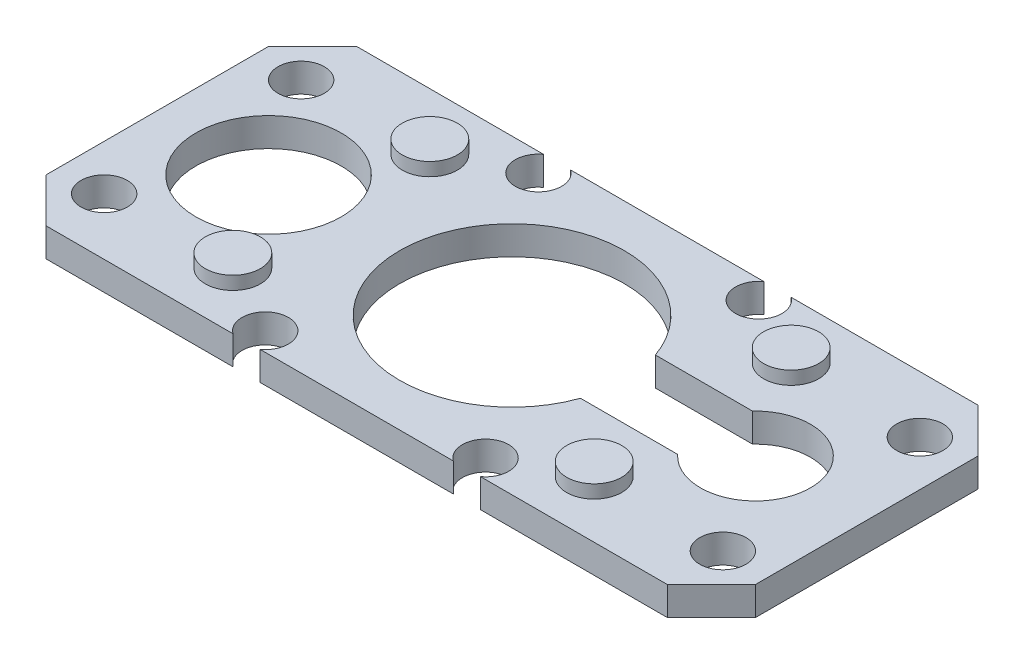
from build123d import *

# Parameters (mm, degrees)
SKETCH1_R           = 1.3335
SKETCH1_R_2         = 1.5875
BOSS_EXTRUDE1_DEPTH = 1.651
CHAMFER1_SIZE       = 2.54
SKETCH1_2_R         = 1.5875
BOSS_EXTRUDE2_DEPTH = 2.413
SKETCH1_3_R         = 1.5875
CUT_EXTRUDE1_DEPTH  = 0.889
SKETCH5_R           = 4.191
CUT_EXTRUDE5_DEPTH  = 23.382376376


with BuildPart() as part:
    # Sketch1 → Boss-Extrude1 (new body)
    with BuildSketch(Plane(origin=(0, 0, 0), x_dir=(1, 0, 0), z_dir=(0, 1, 0))):
        with BuildLine():
            Line((-5.567119422, 8.9535), (5.567119422, 8.9535))
            ThreePointArc((5.567119422, 8.9535), (6.35, 6.5405), (7.132880578, 8.9535))
            Line((7.132880578, 8.9535), (20.447, 8.9535))
            Line((20.447, 8.9535), (20.447, -8.9535))
            Line((20.447, -8.9535), (7.132880578, -8.9535))
            ThreePointArc((7.132880578, -8.9535), (6.35, -6.5405), (5.567119422, -8.9535))
            Line((5.567119422, -8.9535), (-5.567119422, -8.9535))
            ThreePointArc((-5.567119422, -8.9535), (-6.35, -6.5405), (-7.132880578, -8.9535))
            Line((-7.132880578, -8.9535), (-20.447, -8.9535))
            Line((-20.447, -8.9535), (-20.447, 8.9535))
            Line((-20.447, 8.9535), (-7.132880578, 8.9535))
            ThreePointArc((-7.132880578, 8.9535), (-6.35, 6.5405), (-5.567119422, 8.9535))
        make_face()
        with Locations((-17.8308, 5.6769)):
            Circle(SKETCH1_R, mode=Mode.SUBTRACT)
        with Locations((17.8308, 5.6769)):
            Circle(SKETCH1_R, mode=Mode.SUBTRACT)
        with Locations((17.8308, -5.6769)):
            Circle(SKETCH1_R, mode=Mode.SUBTRACT)
        with Locations((-17.8308, -5.6769)):
            Circle(SKETCH1_R, mode=Mode.SUBTRACT)
        with Locations((-10.414, 5.6769)):
            Circle(SKETCH1_R_2, mode=Mode.SUBTRACT)
        with Locations((10.414, 5.6769)):
            Circle(SKETCH1_R_2, mode=Mode.SUBTRACT)
        with Locations((10.414, -5.6769)):
            Circle(SKETCH1_R_2, mode=Mode.SUBTRACT)
        with Locations((-10.414, -5.6769)):
            Circle(SKETCH1_R_2, mode=Mode.SUBTRACT)
    extrude(amount=BOSS_EXTRUDE1_DEPTH)

    # Chamfer1
    chamfer1_edges = [part.edges().sort_by_distance(p)[0] for p in [
        (-20.447, 0.8255, 8.9535),
        (-20.447, 0.8255, -8.9535),
        (20.447, 0.8255, -8.9535),
        (20.447, 0.8255, 8.9535),
    ]]
    chamfer(chamfer1_edges, length=CHAMFER1_SIZE)

    # Sketch1<2> → Boss-Extrude2 (add)
    with BuildSketch(Plane(origin=(0, 0, 0), x_dir=(1, 0, 0), z_dir=(0, 1, 0))):
        with Locations((-10.414, 5.6769)):
            Circle(SKETCH1_2_R)
        with Locations((10.414, 5.6769)):
            Circle(SKETCH1_2_R)
        with Locations((10.414, -5.6769)):
            Circle(SKETCH1_2_R)
        with Locations((-10.414, -5.6769)):
            Circle(SKETCH1_2_R)
    extrude(amount=BOSS_EXTRUDE2_DEPTH)

    # Sketch1<3> → Cut-Extrude1 (cut)
    with BuildSketch(Plane(origin=(0, 0, 0), x_dir=(1, 0, 0), z_dir=(0, 1, 0))):
        with Locations((-10.414, 5.6769)):
            Circle(SKETCH1_3_R)
        with Locations((10.414, 5.6769)):
            Circle(SKETCH1_3_R)
        with Locations((10.414, -5.6769)):
            Circle(SKETCH1_3_R)
        with Locations((-10.414, -5.6769)):
            Circle(SKETCH1_3_R)
    extrude(amount=CUT_EXTRUDE1_DEPTH, mode=Mode.SUBTRACT)

    # Sketch5 → Cut-Extrude5 (cut, through all)
    with BuildSketch(Plane(origin=(0, 1.651, 0), x_dir=(1, 0, 0), z_dir=(0, 1, 0))):
        with Locations((-14.0335, 0)):
            Circle(SKETCH5_R)
        with BuildLine():
            Line((6.106574162, -2.159), (11.705551547, -2.159))
            ThreePointArc((11.705551547, -2.159), (17.2085, 0), (11.705551547, 2.159))
            Line((11.705551547, 2.159), (6.106574162, 2.159))
            ThreePointArc((6.106574162, 2.159), (-6.477, 0), (6.106574162, -2.159))
        make_face()
    extrude(amount=-CUT_EXTRUDE5_DEPTH, mode=Mode.SUBTRACT)


solid = part.part
